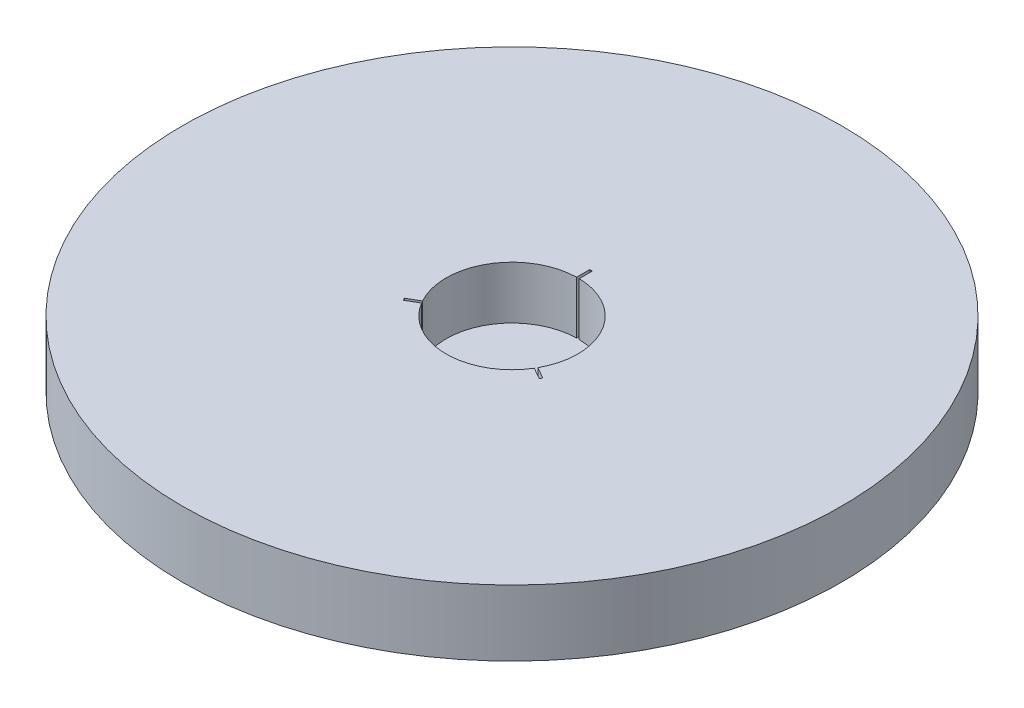
from build123d import *

# Parameters (mm, degrees)
SKETCH_2_R      = 125
EXTRUDE_1_DEPTH = 25
SKETCH_3_R      = 125
EXTRUDE_2_DEPTH = 5


with BuildPart() as part:
    # 草圖2 → 填料-伸長1 (new body)
    with BuildSketch(Plane(origin=(0, 0, 0), x_dir=(1, 0, 0), z_dir=(0, 1, 0))):
        with Locations(Location((0, 0, 0), (0, 0, 270))):
            Circle(SKETCH_2_R)
        with BuildLine():
            Line((26.226431553, -14.564487048), (25.726431553, -15.430512452))
            Line((25.726431553, -15.430512452), (21.396304534, -12.930512452))
            ThreePointArc((21.396304534, -12.930512452), (0, -25), (-21.396304534, -12.930512452))
            Line((-21.396304534, -12.930512452), (-25.726431553, -15.430512452))
            Line((-25.726431553, -15.430512452), (-26.226431553, -14.564487048))
            Line((-26.226431553, -14.564487048), (-21.896304534, -12.064487048))
            ThreePointArc((-21.896304534, -12.064487048), (-21.650635095, 12.5), (-0.5, 24.9949995))
            Line((-0.5, 24.9949995), (-0.5, 29.9949995))
            Line((-0.5, 29.9949995), (0.5, 29.9949995))
            Line((0.5, 29.9949995), (0.5, 24.9949995))
            ThreePointArc((0.5, 24.9949995), (21.650635095, 12.5), (21.896304534, -12.064487048))
            Line((21.896304534, -12.064487048), (26.226431553, -14.564487048))
        make_face(mode=Mode.SUBTRACT)
    extrude(amount=EXTRUDE_1_DEPTH)

    # 草圖3 → 填料-伸長2 (add)
    with BuildSketch(Plane.XZ):
        with Locations(Location((0, 0, 0), (0, 0, 90))):
            Circle(SKETCH_3_R)
    extrude(amount=-EXTRUDE_2_DEPTH)


solid = part.part
